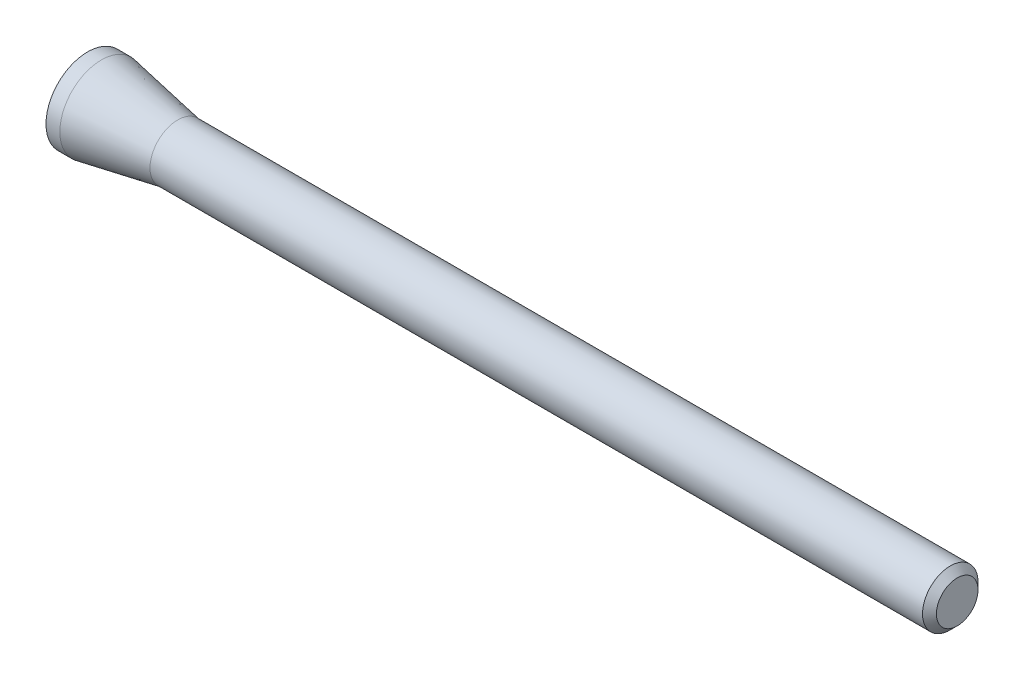
from build123d import *

# Parameters (mm, degrees)
CHAMFER1_SIZE = 0.5


with BuildPart() as part:
    # Sketch1 → Revolve1 (revolve)
    with BuildSketch(Plane.XY):
        Polygon((0, 0), (0, 3), (1, 3), (6.5, 2), (62.7, 2), (62.7, 0), align=None)
    revolve(axis=Axis((-7.597927081, 0, 0), (1, 0, 0)))

    # Chamfer1
    chamfer1_edges = [part.edges().sort_by_distance(p)[0] for p in [
        (62.7, -2, 0),
    ]]
    chamfer(chamfer1_edges, length=CHAMFER1_SIZE)


solid = part.part
